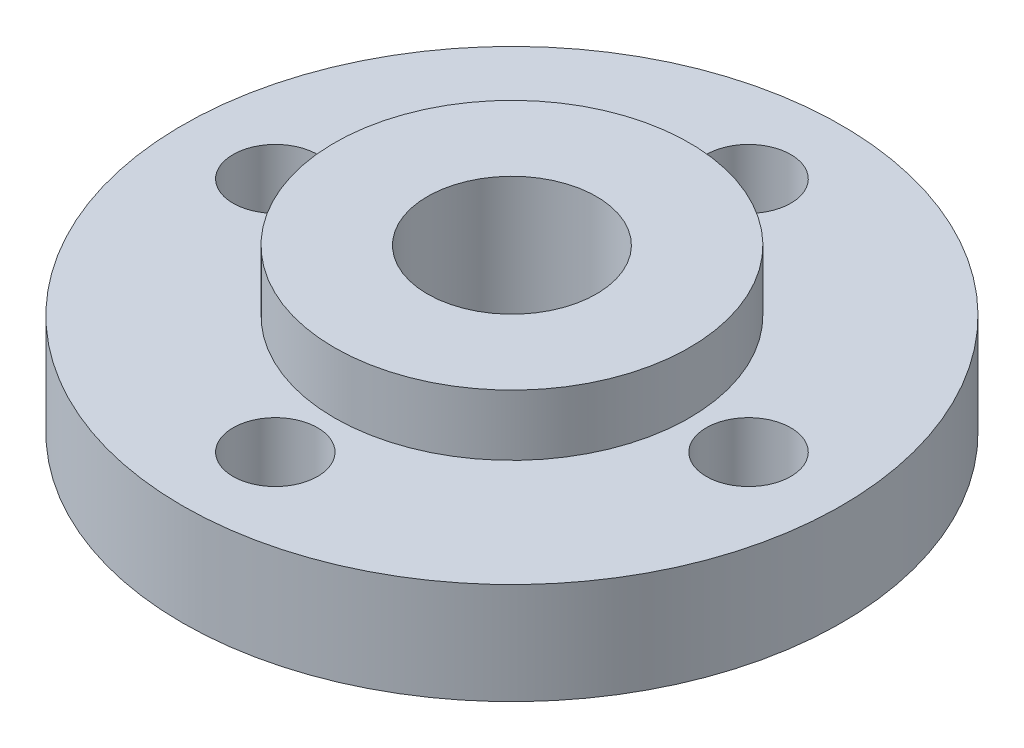
from build123d import *

# Parameters (mm, degrees)
SKETCH_1_R             = 9.75
EXTRUDE_1_DEPTH        = 3
SKETCH_2_R             = 5.25
EXTRUDE_2_DEPTH        = 1.8
SKETCH_3_R             = 2.5
CUT_EXTRUDE_1_DEPTH    = 3.7
HOLE_WIZARD_M3_1_D     = 2.5
HOLE_WIZARD_M3_1_DEPTH = 8.5
HOLE_WIZARD_M3_1_TIP   = 0.751075774
SKETCH_10_R            = 1.5
CUT_EXTRUDE_2_DEPTH    = 3.7


with BuildPart() as part:
    # 草图1 → 凸台-拉伸1 (new body)
    with BuildSketch(Plane(origin=(0, 0, 0), x_dir=(1, 0, 0), z_dir=(0, 1, 0))):
        with Locations(Location((0, 0, 0), (0, 0, 270))):
            Circle(SKETCH_1_R)
    extrude(amount=EXTRUDE_1_DEPTH)

    # 草图2 → 凸台-拉伸2 (add)
    with BuildSketch(Plane(origin=(0, 3, 0), x_dir=(1, 0, 0), z_dir=(0, 1, 0))):
        with Locations(Location((0, 0, 0), (0, 0, 270))):
            Circle(SKETCH_2_R)
    extrude(amount=EXTRUDE_2_DEPTH)

    # 草图3 → 切除-拉伸1 (cut)
    with BuildSketch(Plane(origin=(0, 4.8, 0), x_dir=(1, 0, 0), z_dir=(0, 1, 0))):
        with Locations(Location((0, 0, 0), (0, 0, 270))):
            Circle(SKETCH_3_R)
    extrude(amount=-CUT_EXTRUDE_1_DEPTH, mode=Mode.SUBTRACT)

    # M3 螺纹孔1
    with Locations(Plane(origin=(0, 3, 0), x_dir=(1, 0, 0), z_dir=(0, 1, 0))):
        with Locations((0, 7), (7, 0), (0, -7), (-7, 0)):
            Hole(HOLE_WIZARD_M3_1_D / 2, depth=HOLE_WIZARD_M3_1_DEPTH)
            with Locations((0, 0, -(HOLE_WIZARD_M3_1_DEPTH + HOLE_WIZARD_M3_1_TIP / 2))):  # 118° drill point
                Cone(0, HOLE_WIZARD_M3_1_D / 2, HOLE_WIZARD_M3_1_TIP, mode=Mode.SUBTRACT)

    # 草图10 → 切除-拉伸2 (cut)
    with BuildSketch(Plane(origin=(0, 1.1, 0), x_dir=(1, 0, 0), z_dir=(0, 1, 0))):
        with Locations(Location((0, 0, 0), (0, 0, 270))):
            Circle(SKETCH_10_R)
    extrude(amount=-CUT_EXTRUDE_2_DEPTH, mode=Mode.SUBTRACT)


solid = part.part
